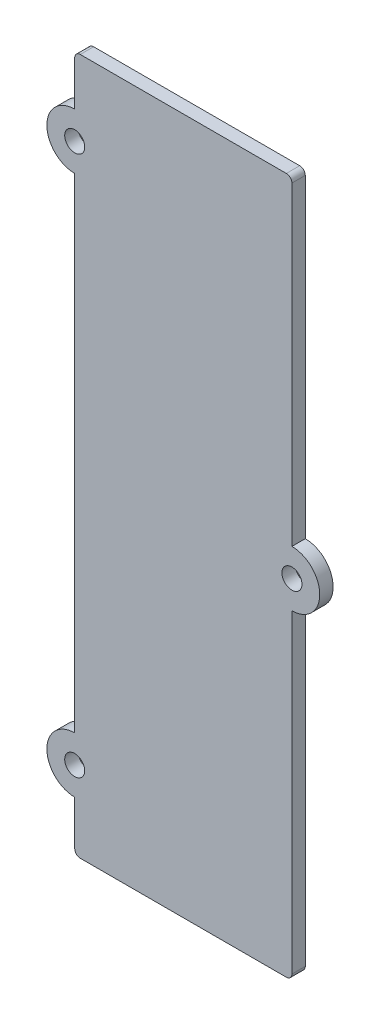
from build123d import *

# Parameters (mm, degrees)
SKETCH1_W           = 24.765
SKETCH1_H           = 79.375
BOSS_EXTRUDE1_DEPTH = 1.524
SKETCH2_R           = 3.175
BOSS_EXTRUDE2_DEPTH = 1.524
SKETCH3_R           = 1.143
CUT_EXTRUDE1_DEPTH  = 85.162680572
FILLET1_R           = 0.635


with BuildPart() as part:
    # Sketch1 → Boss-Extrude1 (new body)
    with BuildSketch(Plane.XY):
        with Locations((12.3825, 39.6875)):
            Rectangle(SKETCH1_W, SKETCH1_H)
    extrude(amount=BOSS_EXTRUDE1_DEPTH)

    # Sketch2 → Boss-Extrude2 (add)
    with BuildSketch(Plane.XY.offset(1.524)):
        with Locations((0, 8.89)):
            Circle(SKETCH2_R)
        with Locations((24.765, 39.6875)):
            Circle(SKETCH2_R)
        with Locations((0, 70.485)):
            Circle(SKETCH2_R)
    extrude(amount=-BOSS_EXTRUDE2_DEPTH)

    # Sketch3 → Cut-Extrude1 (cut, through all)
    with BuildSketch(Plane.XY.offset(1.524)):
        with Locations((0, 8.89)):
            Circle(SKETCH3_R)
        with Locations((24.765, 39.6875)):
            Circle(SKETCH3_R)
        with Locations((0, 70.485)):
            Circle(SKETCH3_R)
    extrude(amount=-CUT_EXTRUDE1_DEPTH, mode=Mode.SUBTRACT)

    # Fillet1
    fillet1_edges = [part.edges().sort_by_distance(p)[0] for p in [
        (0, 79.375, 0.762),
        (24.765, 79.375, 0.762),
        (24.765, 0, 0.762),
        (0, 0, 0.762),
    ]]
    fillet(fillet1_edges, radius=FILLET1_R)


solid = part.part
